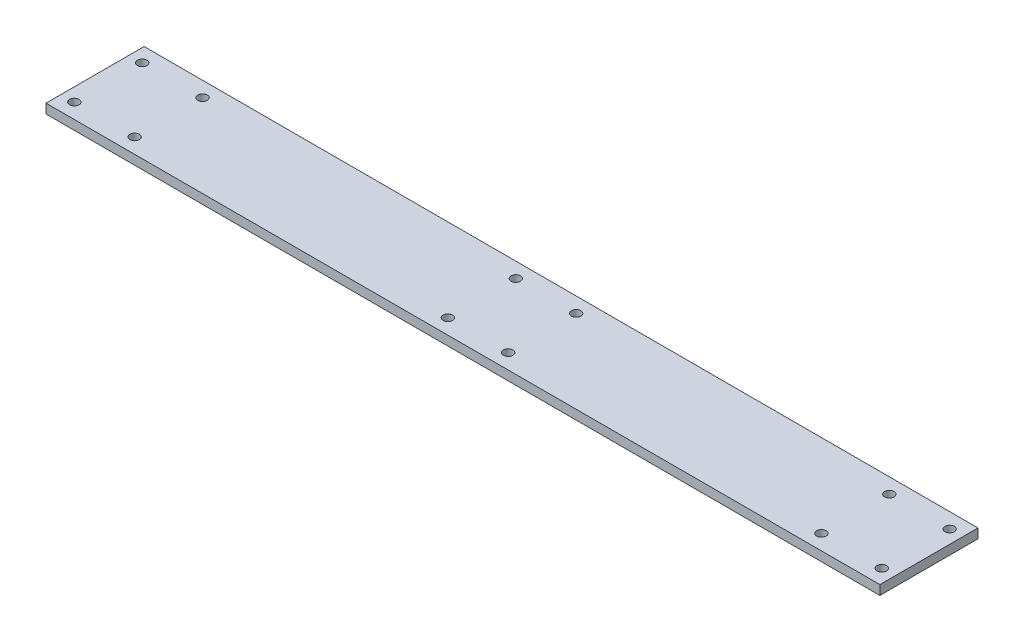
from build123d import *

# Parameters (mm, degrees)
SKETCH_1_W          = 442
SKETCH_1_H          = 52
EXTRUDE_1_DEPTH     = 5
SKETCH_2_R          = 2.5
CUT_EXTRUDE_1_DEPTH = 446.076397936


with BuildPart() as part:
    # 草图1 → 凸台-拉伸1 (new body)
    with BuildSketch(Plane(origin=(0, 0, 0), x_dir=(1, 0, 0), z_dir=(0, 1, 0))):
        with Locations((221, 26)):
            Rectangle(SKETCH_1_W, SKETCH_1_H)
    extrude(amount=EXTRUDE_1_DEPTH)

    # 草图2 → 切除-拉伸1 (cut, through all)
    with BuildSketch(Plane(origin=(0, 5, 0), x_dir=(1, 0, 0), z_dir=(0, 1, 0))):
        with Locations(Location((205, 8, 0), (0, 0, 270))):
            Circle(SKETCH_2_R)
        with Locations(Location((237, 8, 0), (0, 0, 90))):
            Circle(SKETCH_2_R)
        with Locations(Location((205, 44, 0), (0, 0, 90))):
            Circle(SKETCH_2_R)
        with Locations(Location((237, 44, 0), (0, 0, 270))):
            Circle(SKETCH_2_R)
        with Locations(Location((435, 44, 0), (0, 0, 270))):
            Circle(SKETCH_2_R)
        with Locations(Location((403, 44, 0), (0, 0, 90))):
            Circle(SKETCH_2_R)
        with Locations(Location((403, 8, 0), (0, 0, 270))):
            Circle(SKETCH_2_R)
        with Locations(Location((435, 8, 0), (0, 0, 90))):
            Circle(SKETCH_2_R)
        with Locations(Location((7, 44, 0), (0, 0, 90))):
            Circle(SKETCH_2_R)
        with Locations(Location((39, 44, 0), (0, 0, 270))):
            Circle(SKETCH_2_R)
        with Locations(Location((39, 8, 0), (0, 0, 90))):
            Circle(SKETCH_2_R)
        with Locations(Location((7, 8, 0), (0, 0, 270))):
            Circle(SKETCH_2_R)
    extrude(amount=-CUT_EXTRUDE_1_DEPTH, mode=Mode.SUBTRACT)


solid = part.part
